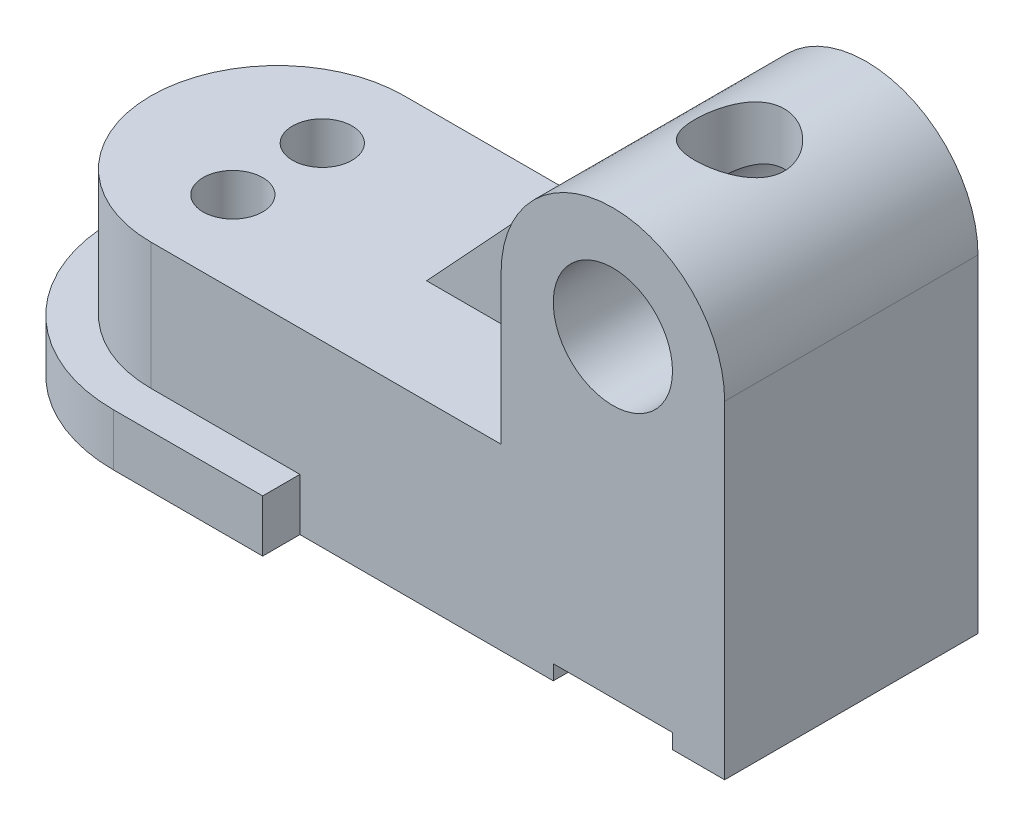
from build123d import *

# Parameters (mm, degrees)
EXTRUDE_1_DEPTH      = 7
EXTRUDE_2_DEPTH      = 17
EXTRUDE_2_DEPTH_BACK = 7
CUT_EXTRUDE_1_DEPTH  = 16
CUT_EXTRUDE_2_REACH  = 76.492
SKETCH_5_R           = 4
SKETCH_6_W           = 30
SKETCH_6_H           = 34
EXTRUDE_3_DEPTH      = 20
EXTRUDE_4_DEPTH      = 34
CUT_EXTRUDE_3_REACH  = 99.422
SKETCH_8_R           = 8
RIB_1_REACH          = 93.946
SKETCH_9_WALL_W      = 227.073790214
SKETCH_9_WALL_H      = 6
SKETCH_10_R          = 6
CUT_EXTRUDE_4_DEPTH  = 92.945634825
SKETCH_11_W          = 16
SKETCH_11_H          = 4
CUT_EXTRUDE_5_DEPTH  = 98.421762397
SKETCH_12_W          = 48.790865184
SKETCH_12_H          = 10
CUT_EXTRUDE_8_DEPTH  = 16


with BuildPart() as part:
    # 草图1 → 凸台-拉伸1 (new body)
    with BuildSketch(Plane(origin=(0, 0, 0), x_dir=(1, 0, 0), z_dir=(0, 1, 0))):
        with BuildLine():
            Line((10, -22), (-10, -22))
            ThreePointArc((-10, -22), (-32, 0), (-10, 22))
            Line((-10, 22), (10, 22))
            Line((10, 22), (10, -22))
        make_face()
    extrude(amount=EXTRUDE_1_DEPTH)

    # 草图3 → 凸台-拉伸2 (add, two sides: drawn at the far end of the back side and taken through both)
    with BuildSketch(Plane(origin=(0, 7, 0), x_dir=(1, 0, 0), z_dir=(0, 1, 0)).offset(-EXTRUDE_2_DEPTH_BACK)):
        with BuildLine():
            Line((-10, 17), (66.999998234, 17))
            Line((66.999998234, 17), (66.999998234, -17))
            Line((66.999998234, -17), (-10.000001766, -17))
            ThreePointArc((-10.000001766, -17), (-27, 8.83e-07), (-10, 17))
        make_face()
    extrude(amount=EXTRUDE_2_DEPTH + EXTRUDE_2_DEPTH_BACK)

    # 草图4 → 切除-拉伸1 (cut)
    with BuildSketch(Plane.XZ):
        with BuildLine():
            Line((-10, 12), (26, 12))
            Line((26, 12), (26, -12))
            Line((26, -12), (-10, -12))
            ThreePointArc((-10, -12), (-22, 0), (-10, 12))
        make_face()
    extrude(amount=-CUT_EXTRUDE_1_DEPTH, mode=Mode.SUBTRACT)

    # 草图5 → 切除-拉伸2 (cut, up to next)
    with BuildSketch(Plane(origin=(0, 24, 0), x_dir=(1, 0, 0), z_dir=(0, 1, 0)), mode=Mode.PRIVATE) as cut_extrude_2_sk1:
        with Locations(Location((-10, 6, 0), (0, 0, 270))):
            Circle(SKETCH_5_R)
    cut_extrude_2_tool1 = extrude(cut_extrude_2_sk1.sketch, amount=-CUT_EXTRUDE_2_REACH, mode=Mode.PRIVATE) & part.part
    # 草图5 → 切除-拉伸2 (cut, up to next)
    with BuildSketch(Plane(origin=(0, 24, 0), x_dir=(1, 0, 0), z_dir=(0, 1, 0)), mode=Mode.PRIVATE) as cut_extrude_2_sk2:
        with Locations(Location((-10, -6, 0), (0, 0, 270))):
            Circle(SKETCH_5_R)
    cut_extrude_2_tool2 = extrude(cut_extrude_2_sk2.sketch, amount=-CUT_EXTRUDE_2_REACH, mode=Mode.PRIVATE) & part.part
    add(cut_extrude_2_tool1.solids().sort_by_distance((-10, 24, -6))[0], mode=Mode.SUBTRACT)
    add(cut_extrude_2_tool2.solids().sort_by_distance((-10, 24, 6))[0], mode=Mode.SUBTRACT)

    # 草图6 → 凸台-拉伸3 (add)
    with BuildSketch(Plane(origin=(0, 24, 0), x_dir=(1, 0, 0), z_dir=(0, 1, 0))):
        with Locations((51.999998234, 0)):
            Rectangle(SKETCH_6_W, SKETCH_6_H)
    extrude(amount=EXTRUDE_3_DEPTH)

    # 草图7 → 凸台-拉伸4 (add)
    with BuildSketch(Plane.XY.offset(17)):
        with BuildLine():
            ThreePointArc((36.999998234, 44), (51.999998234, 59), (66.999998234, 44))
            Line((66.999998234, 44), (36.999998234, 44))
        make_face()
    extrude(amount=-EXTRUDE_4_DEPTH)

    # 草图8 → 切除-拉伸3 (cut, up to next)
    with BuildSketch(Plane.XY.offset(17), mode=Mode.PRIVATE) as cut_extrude_3_sk1:
        with Locations((51.999998234, 44)):
            Circle(SKETCH_8_R)
    cut_extrude_3_tool1 = extrude(cut_extrude_3_sk1.sketch, amount=-CUT_EXTRUDE_3_REACH, mode=Mode.PRIVATE) & part.part
    add(cut_extrude_3_tool1.solids().sort_by_distance((51.999998, 44, 17))[0], mode=Mode.SUBTRACT)

    # 草图9 wall → 筋1 (add, up to next)
    with BuildSketch(Plane(origin=(27.00032198, 39.099368696, 0), x_dir=(0.679915826137, 0.733290167238, 0), z_dir=(-0.733290167238, 0.679915826137, 0)), mode=Mode.PRIVATE) as rib_1_sk1:
        Rectangle(SKETCH_9_WALL_W, SKETCH_9_WALL_H)
    rib_1_tool1 = extrude(rib_1_sk1.sketch, amount=-RIB_1_REACH, mode=Mode.PRIVATE) - part.part
    add(rib_1_tool1.solids().sort_by_distance((27.00032198, 39.099368696, 0))[0])

    # 草图10 → 切除-拉伸4 (cut, through all)
    with BuildSketch(Plane(origin=(0, 59, 0), x_dir=(1, 0, 0), z_dir=(0, 1, 0))):
        with Locations(Location((51.999998234, 0, 0), (0, 0, 270))):
            Circle(SKETCH_10_R)
    extrude(amount=-CUT_EXTRUDE_4_DEPTH, mode=Mode.SUBTRACT)

    # 草图11 → 切除-拉伸5 (cut, through all)
    with BuildSketch(Plane.XY.offset(17)):
        with Locations((51.999998234, 0)):
            Rectangle(SKETCH_11_W, SKETCH_11_H)
    extrude(amount=-CUT_EXTRUDE_5_DEPTH, mode=Mode.SUBTRACT)

    # 草图12 → 切除-拉伸8 (cut)
    with BuildSketch(Plane.XZ):
        with Locations((26, 0)):
            Rectangle(SKETCH_12_W, SKETCH_12_H)
    extrude(amount=-CUT_EXTRUDE_8_DEPTH, mode=Mode.SUBTRACT)


solid = part.part
